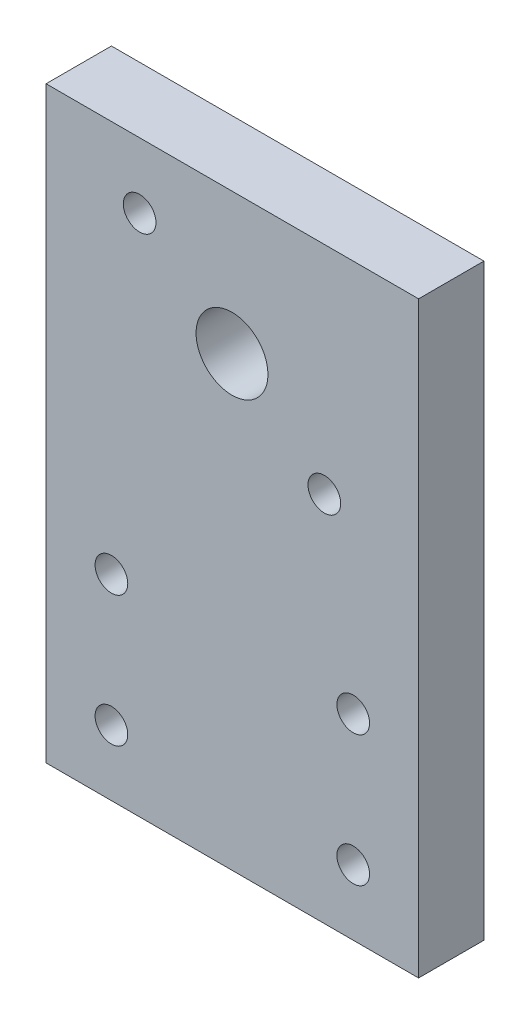
from build123d import *

# Parameters (mm, degrees)
SKETCH1_W           = 57
SKETCH1_H           = 90
BOSS_EXTRUDE1_DEPTH = 10
SKETCH2_R           = 2.5
SKETCH2_R_2         = 5.5
CUT_EXTRUDE1_DEPTH  = 10


with BuildPart() as part:
    # Sketch1 → Boss-Extrude1 (new body)
    with BuildSketch(Plane.XY):
        with Locations((28.5, 45)):
            Rectangle(SKETCH1_W, SKETCH1_H)
    extrude(amount=BOSS_EXTRUDE1_DEPTH)

    # Sketch2 → Cut-Extrude1 (cut)
    with BuildSketch(Plane.XY.offset(10)):
        with Locations((47, 10)):
            Circle(SKETCH2_R)
        with Locations((10, 30)):
            Circle(SKETCH2_R)
        with Locations((47, 30)):
            Circle(SKETCH2_R)
        with Locations((10, 10)):
            Circle(SKETCH2_R)
        with Locations((28.45, 68.45)):
            Circle(SKETCH2_R_2)
        with Locations((42.580109695, 56.9)):
            Circle(SKETCH2_R)
        with Locations((14.319890305, 80)):
            Circle(SKETCH2_R)
    extrude(amount=-CUT_EXTRUDE1_DEPTH, mode=Mode.SUBTRACT)


solid = part.part
